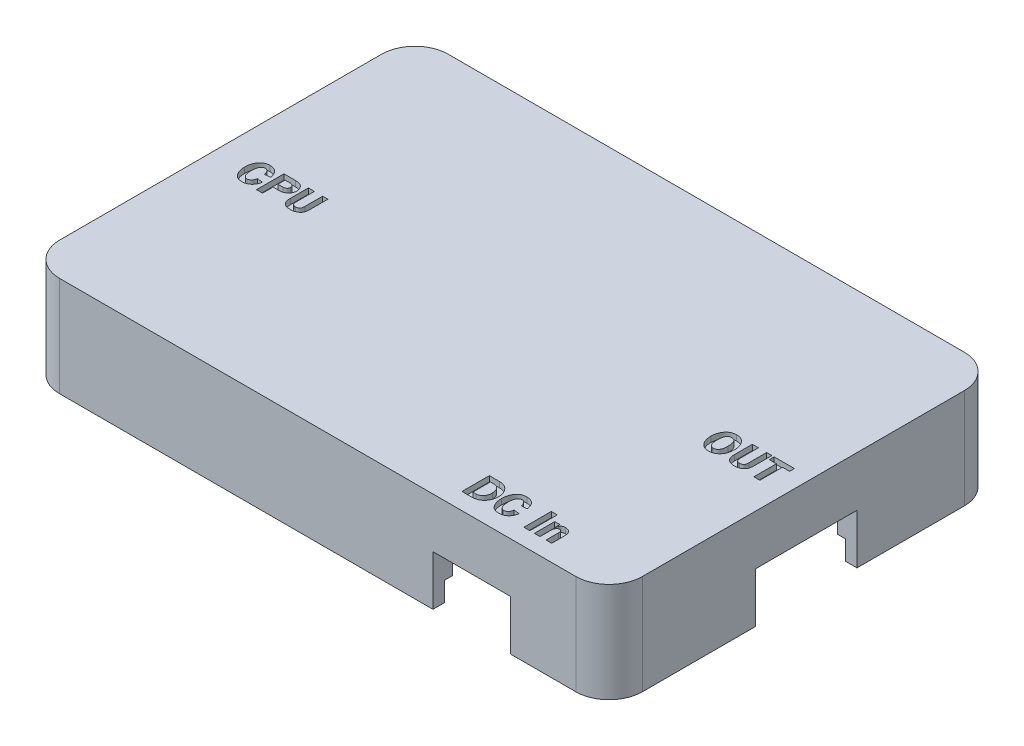
from build123d import *

# Parameters (mm, degrees)
SKETCH1_W           = 105
SKETCH1_H           = 70
BOSS_EXTRUDE1_DEPTH = 15
SKETCH3_W           = 98
SKETCH3_H           = 63
CUT_EXTRUDE1_DEPTH  = 12
FILLET1_R           = 6
SKETCH6_W           = 3.5
SKETCH6_H           = 18.3
SKETCH6_W_2         = 14
SKETCH6_H_2         = 3.5
SKETCH6_H_3         = 20
CUT_EXTRUDE3_DEPTH  = 26
CUT_EXTRUDE4_START  = -10
CUT_EXTRUDE4_DEPTH  = 10
BOSS_EXTRUDE3_DEPTH = 3
CUT_EXTRUDE5_DEPTH  = 3.5
SKETCH12_W          = 3.5
SKETCH12_H          = 18.3
SKETCH12_W_2        = 14
SKETCH12_H_2        = 3.5
SKETCH12_H_3        = 20
BOSS_EXTRUDE4_DEPTH = 6
SKETCH13_W          = 1.08279823
SKETCH13_H          = 4.940266927
CUT_EXTRUDE6_DEPTH  = 1


with BuildPart() as part:
    # Sketch1 → Boss-Extrude1 (new body)
    with BuildSketch(Plane(origin=(0, 0, 0), x_dir=(1, 0, 0), z_dir=(0, 1, 0))):
        Rectangle(SKETCH1_W, SKETCH1_H)
    extrude(amount=BOSS_EXTRUDE1_DEPTH)

    # Sketch3 → Cut-Extrude1 (cut)
    with BuildSketch(Plane(origin=(0, 15, 0), x_dir=(1, 0, 0), z_dir=(0, 1, 0))):
        Rectangle(SKETCH3_W, SKETCH3_H)
    extrude(amount=-CUT_EXTRUDE1_DEPTH, mode=Mode.SUBTRACT)

    # Fillet1
    fillet1_edges = [part.edges().sort_by_distance(p)[0] for p in [
        (-49, 9, 31.5),
        (-49, 9, -31.5),
        (49, 9, -31.5),
        (49, 9, 31.5),
        (52.5, 7.5, 35),
        (-52.5, 7.5, 35),
        (-52.5, 7.5, -35),
        (52.5, 7.5, -35),
    ]]
    fillet(fillet1_edges, radius=FILLET1_R)

    # Sketch6 → Cut-Extrude3 (cut)
    with BuildSketch(Plane(origin=(0, 15, 0), x_dir=(1, 0, 0), z_dir=(0, 1, 0))):
        with Locations((50.75, 0.51)):
            Rectangle(SKETCH6_W, SKETCH6_H)
        with Locations((27.76, -33.25)):
            Rectangle(SKETCH6_W_2, SKETCH6_H_2)
        with Locations((-50.75, 0)):
            Rectangle(SKETCH6_W, SKETCH6_H_3)
    extrude(amount=-CUT_EXTRUDE3_DEPTH, mode=Mode.SUBTRACT)

    # Sketch9 → Cut-Extrude4 (cut)
    with BuildSketch(Plane(origin=(0, 3, 0), x_dir=(1, 0, 0), z_dir=(0, 1, 0)).offset(CUT_EXTRUDE4_START)):
        with BuildLine():
            Line((-43, 31.5), (43, 31.5))
            ThreePointArc((43, 31.5), (47.242640687, 29.742640687), (49, 25.5))
            Line((49, 25.5), (49, -25.5))
            ThreePointArc((49, -25.5), (47.242640687, -29.742640687), (43, -31.5))
            Line((43, -31.5), (-43, -31.5))
            ThreePointArc((-43, -31.5), (-47.242640687, -29.742640687), (-49, -25.5))
            Line((-49, -25.5), (-49, 25.5))
            ThreePointArc((-49, 25.5), (-47.242640687, 29.742640687), (-43, 31.5))
        make_face()
    extrude(amount=CUT_EXTRUDE4_DEPTH, mode=Mode.SUBTRACT)


with BuildPart() as cut_extrude4_piece_1:
    # of the separate pieces the step leaves, piece 1, a body of its own (cut_extrude4_pieces)
    add(part.part.solids().sort_by_distance((-46.5, 0, -35))[0])

    # Sketch10 → Boss-Extrude3 (add)
    with BuildSketch(Plane(origin=(0, 15, 0), x_dir=(1, 0, 0), z_dir=(0, 1, 0))):
        with BuildLine():
            Line((-46.5, 35), (46.5, 35))
            ThreePointArc((46.5, 35), (50.742640687, 33.242640687), (52.5, 29))
            Line((52.5, 29), (52.5, -29))
            ThreePointArc((52.5, -29), (50.742640687, -33.242640687), (46.5, -35))
            Line((46.5, -35), (-46.5, -35))
            ThreePointArc((-46.5, -35), (-50.742640687, -33.242640687), (-52.5, -29))
            Line((-52.5, -29), (-52.5, 29))
            ThreePointArc((-52.5, 29), (-50.742640687, 33.242640687), (-46.5, 35))
        make_face()
    extrude(amount=BOSS_EXTRUDE3_DEPTH)


with BuildPart() as cut_extrude4_piece_2:
    # of the separate pieces the step leaves, piece 2, a body of its own (cut_extrude4_pieces)
    add(part.part.solids().sort_by_distance((-52.5, 0, 10))[0])


with BuildPart() as cut_extrude4_piece_3:
    # of the separate pieces the step leaves, piece 3, a body of its own (cut_extrude4_pieces)
    add(part.part.solids().sort_by_distance((49, 0, 8.64))[0])


with BuildPart() as cut_extrude5_tool:
    # Sketch11 → Cut-Extrude5 (new body)
    with BuildSketch(Plane(origin=(0, 0, 0), x_dir=(-1, 0, 0), z_dir=(0, -1, 0))):
        with BuildLine():
            Line((-44.4, 32.9), (44.4, 32.9))
            ThreePointArc((44.4, 32.9), (48.642640687, 31.142640687), (50.4, 26.9))
            Line((50.4, 26.9), (50.4, -26.9))
            ThreePointArc((50.4, -26.9), (48.642640687, -31.142640687), (44.4, -32.9))
            Line((44.4, -32.9), (-44.4, -32.9))
            ThreePointArc((-44.4, -32.9), (-48.642640687, -31.142640687), (-50.4, -26.9))
            Line((-50.4, -26.9), (-50.4, 26.9))
            ThreePointArc((-50.4, 26.9), (-48.642640687, 31.142640687), (-44.4, 32.9))
        make_face()
    extrude(amount=-CUT_EXTRUDE5_DEPTH)


with BuildPart() as cut_extrude4_piece_1_1:
    add(cut_extrude4_piece_1.part)

    # Cut-Extrude5: cut by cut_extrude5_tool
    add(cut_extrude5_tool.part, mode=Mode.SUBTRACT)



with BuildPart() as cut_extrude4_piece_2_1:
    add(cut_extrude4_piece_2.part)

    # Cut-Extrude5: cut by cut_extrude5_tool
    add(cut_extrude5_tool.part, mode=Mode.SUBTRACT)


with BuildPart() as cut_extrude4_piece_3_1:
    add(cut_extrude4_piece_3.part)

    # Cut-Extrude5: cut by cut_extrude5_tool
    add(cut_extrude5_tool.part, mode=Mode.SUBTRACT)


with BuildPart() as cut_extrude4_piece_1_2:
    add(cut_extrude4_piece_1_1.part)

    add(cut_extrude4_piece_2_1.part)  # Boss-Extrude4 merges Cut-Extrude4 piece 2

    add(cut_extrude4_piece_3_1.part)  # Boss-Extrude4 merges Cut-Extrude4 piece 3
    # Sketch12 → Boss-Extrude4 (add)
    with BuildSketch(Plane(origin=(0, 15, 0), x_dir=(-1, 0, 0), z_dir=(0, -1, 0))):
        with Locations((-50.75, 0.51)):
            Rectangle(SKETCH12_W, SKETCH12_H)
        with Locations((-27.76, -33.25)):
            Rectangle(SKETCH12_W_2, SKETCH12_H_2)
        with Locations((50.75, 0)):
            Rectangle(SKETCH12_W, SKETCH12_H_3)
    extrude(amount=BOSS_EXTRUDE4_DEPTH)

    # Sketch13 → Cut-Extrude6 (cut)
    # profile 1 of 10: a face of its own
    with BuildSketch(Plane(origin=(0, 18, 0), x_dir=(1, 0, 0), z_dir=(0, 1, 0))):
        with BuildLine():
            Line((-44.296016954, -1.604778249), (-43.287238134, -1.707348003))
            add(Edge.make_bspline(
                [(-43.287238134, -1.707348003), (-43.294953974, -1.770974891), (-43.31014873, -1.896274934), (-43.351483151, -2.07847792), (-43.403300697, -2.252766555), (-43.471670087, -2.416980091), (-43.552527511, -2.572136055), (-43.645316172, -2.719320307), (-43.754460427, -2.855478557), (-43.87404291, -2.983967734), (-44.007357324, -3.098613342), (-44.150792504, -3.200412741), (-44.306288288, -3.285363261), (-44.472928079, -3.353606277), (-44.64985806, -3.407995095), (-44.837439678, -3.44677983), (-45.035950388, -3.470528648), (-45.171845488, -3.473021879), (-45.241350566, -3.474297069)],
                knots=[0, 0, 0, 0, 1.051982192, 2.07166211, 3.064163433, 4.034902158, 4.987714795, 5.935166584, 6.887152378, 7.84950099, 8.813936601, 9.76952359, 10.733246651, 11.716896322, 12.722162435, 13.768923523, 14.858890826, 16, 16, 16, 16], degree=3))
            add(Edge.make_bspline(
                [(-45.241350566, -3.474297069), (-45.297073434, -3.473293841), (-45.405935008, -3.471333909), (-45.565144792, -3.45570261), (-45.715823592, -3.427543834), (-45.85949537, -3.391358362), (-45.99440018, -3.342408973), (-46.12191451, -3.284209572), (-46.2405956, -3.213874232), (-46.351945258, -3.133325988), (-46.454954218, -3.043132503), (-46.552282622, -2.946124841), (-46.64258613, -2.841502763), (-46.728196115, -2.730109147), (-46.805464075, -2.610130305), (-46.879734671, -2.484407137), (-46.944001726, -2.349518243), (-47.005150373, -2.209323742), (-47.056786136, -2.062587037), (-47.104174632, -1.912717561), (-47.141866561, -1.758166883), (-47.173250519, -1.600417191), (-47.199143137, -1.438947266), (-47.216778721, -1.274126348), (-47.22777127, -1.105475857), (-47.228786819, -0.991844224), (-47.229300442, -0.934373876)],
                knots=[0, 0, 0, 0, 1.105609578, 2.159946219, 3.169608684, 4.145018578, 5.096309205, 6.013193973, 6.922417586, 7.828974177, 8.736285872, 9.636371327, 10.553549476, 11.476787637, 12.421499323, 13.383578628, 14.372015653, 15.3840493, 16.417202389, 17.456939369, 18.501862101, 19.571742627, 20.648005113, 21.745532771, 22.859780399, 24, 24, 24, 24], degree=3))
            add(Edge.make_bspline(
                [(-47.229300442, -0.934373876), (-47.227740336, -0.843376833), (-47.224686341, -0.665245107), (-47.198912585, -0.404419674), (-47.156562558, -0.156452062), (-47.099311551, 0.079554926), (-47.022295431, 0.30195272), (-46.931216528, 0.512749207), (-46.81961203, 0.708893215), (-46.695336607, 0.892767541), (-46.554712403, 1.058764643), (-46.401255336, 1.205378481), (-46.232826735, 1.327380308), (-46.052407775, 1.427580587), (-45.859954683, 1.50688588), (-45.653966302, 1.560785937), (-45.436086991, 1.596255408), (-45.286260548, 1.599605927), (-45.209627961, 1.601319637)],
                knots=[0, 0, 0, 0, 1.198178484, 2.345500427, 3.447453775, 4.509103708, 5.539599216, 6.543499879, 7.528638035, 8.507148543, 9.462269331, 10.388250012, 11.295364851, 12.193024101, 13.10070884, 14.028537591, 14.991644863, 16, 16, 16, 16], degree=3))
            add(Edge.make_bspline(
                [(-45.209627961, 1.601319637), (-45.1454052, 1.599996685), (-45.019732846, 1.597407908), (-44.835885515, 1.574235883), (-44.660566268, 1.538883432), (-44.493998681, 1.488170289), (-44.336413268, 1.422166277), (-44.187540934, 1.341493634), (-44.047694246, 1.245647795), (-43.916151696, 1.136833749), (-43.795191782, 1.013657658), (-43.685965063, 0.876938173), (-43.589813638, 0.726419725), (-43.503701315, 0.564480455), (-43.430445575, 0.388891876), (-43.371313857, 0.19987699), (-43.320391621, -0.001127881), (-43.298458653, -0.140735254), (-43.287238134, -0.212155916)],
                knots=[0, 0, 0, 0, 1.053980237, 2.062449089, 3.037335328, 3.987379173, 4.915943175, 5.837774954, 6.762291017, 7.69511876, 8.636291522, 9.591555379, 10.562673013, 11.564478635, 12.599430281, 13.681008754, 14.813645119, 16, 16, 16, 16], degree=3))
            Line((-43.287238134, -0.212155916), (-44.288615013, -0.309438569))
            add(Edge.make_bspline(
                [(-44.288615013, -0.309438569), (-44.298191999, -0.267778765), (-44.316869871, -0.186530178), (-44.348919086, -0.069366921), (-44.386931586, 0.039231513), (-44.425823374, 0.140556243), (-44.471062158, 0.232970844), (-44.51836527, 0.318171086), (-44.569748786, 0.39512553), (-44.625341202, 0.463809165), (-44.684767561, 0.524008011), (-44.747113968, 0.57766644), (-44.814023883, 0.622109115), (-44.884682408, 0.658413598), (-44.958681954, 0.687104291), (-45.036720058, 0.70734755), (-45.118342155, 0.718903761), (-45.17399236, 0.720656724), (-45.20222602, 0.721546074)],
                knots=[0, 0, 0, 0, 1.364641525, 2.661443042, 3.874868095, 5.036638674, 6.123695894, 7.156520859, 8.145828854, 9.073718286, 9.972847736, 10.84306696, 11.695053518, 12.530457183, 13.374680603, 14.223466012, 15.098690498, 16, 16, 16, 16], degree=3))
            add(Edge.make_bspline(
                [(-45.20222602, 0.721546074), (-45.233699233, 0.720373973), (-45.295828138, 0.718060216), (-45.386637343, 0.698184391), (-45.473521274, 0.666515715), (-45.554942501, 0.620292169), (-45.63248488, 0.562100857), (-45.704937964, 0.491085011), (-45.773310144, 0.407387809), (-45.836497465, 0.311098652), (-45.893897507, 0.201478584), (-45.943076874, 0.078369939), (-45.985287672, -0.057780132), (-46.020150287, -0.207210061), (-46.045923923, -0.370537246), (-46.064693422, -0.54735451), (-46.076351277, -0.737538998), (-46.077984856, -0.86879676), (-46.078827322, -0.936488716)],
                knots=[0, 0, 0, 0, 0.726895696, 1.434910162, 2.138785806, 2.857458904, 3.590857252, 4.374590525, 5.196778853, 6.085005742, 7.032695212, 8.052607015, 9.145406711, 10.325446451, 11.59680084, 12.965544286, 14.435077357, 16, 16, 16, 16], degree=3))
            add(Edge.make_bspline(
                [(-46.078827322, -0.936488716), (-46.078098958, -1.005244616), (-46.076689454, -1.1382985), (-46.0635621, -1.330569576), (-46.044172784, -1.508923422), (-46.015863734, -1.673230806), (-45.979118578, -1.82387155), (-45.934228934, -1.960716155), (-45.88006297, -2.083111306), (-45.818858368, -2.191594612), (-45.750841469, -2.28611622), (-45.678483509, -2.367801543), (-45.603993932, -2.438551801), (-45.524505654, -2.494804116), (-45.44287067, -2.540769894), (-45.356061462, -2.570715591), (-45.266266399, -2.591140692), (-45.204809557, -2.593386026), (-45.173675676, -2.594523507)],
                knots=[0, 0, 0, 0, 1.578182673, 3.054040949, 4.422086023, 5.695161059, 6.87854739, 7.978818638, 8.996746236, 9.946184514, 10.833196196, 11.664422499, 12.448801434, 13.185309597, 13.895016738, 14.591171581, 15.286291109, 16, 16, 16, 16], degree=3))
            add(Edge.make_bspline(
                [(-45.173675676, -2.594523507), (-45.145433254, -2.593710421), (-45.089365261, -2.592096251), (-45.007050163, -2.579246027), (-44.927726712, -2.557723276), (-44.851639269, -2.528388738), (-44.778620871, -2.489569183), (-44.709355289, -2.442110432), (-44.643156759, -2.386138078), (-44.579911989, -2.323359004), (-44.522205835, -2.252589632), (-44.470208463, -2.176168216), (-44.42427863, -2.094192509), (-44.385803598, -2.006506064), (-44.352046778, -1.913879685), (-44.328000735, -1.815432718), (-44.306551567, -1.712286918), (-44.299584144, -1.641182419), (-44.296016954, -1.604778249)],
                knots=[0, 0, 0, 0, 0.929161302, 1.844608371, 2.733809141, 3.629943943, 4.52246771, 5.449091207, 6.387761928, 7.372056715, 8.377585556, 9.387853863, 10.410894549, 11.465029895, 12.536385021, 13.650531068, 14.797115969, 16, 16, 16, 16], degree=3))
        make_face()
    # profile 2 of 10: a face of its own
    with BuildSketch(Plane(origin=(0, 18, 0), x_dir=(1, 0, 0), z_dir=(0, 1, 0))):
        with BuildLine():
            Line((-41.544609732, -3.40662218), (-42.627407962, -3.40662218))
            Line((-42.627407962, -3.40662218), (-42.627407962, 1.533644747))
            Line((-42.627407962, 1.533644747), (-40.574955457, 1.533644747))
            add(Edge.make_bspline(
                [(-40.574955457, 1.533644747), (-40.500183136, 1.532218845), (-40.355609874, 1.529461844), (-40.146205874, 1.508472985), (-39.952088646, 1.472546801), (-39.772459703, 1.423753739), (-39.608544211, 1.35867853), (-39.459143738, 1.280839987), (-39.325795407, 1.186918076), (-39.208550235, 1.079423135), (-39.105973853, 0.963657766), (-39.016083499, 0.843029771), (-38.939628994, 0.718743641), (-38.878237324, 0.589419669), (-38.828488216, 0.457074363), (-38.795707586, 0.319879818), (-38.7728023, 0.179153333), (-38.770902094, 0.083664352), (-38.769939266, 0.035280399)],
                knots=[0, 0, 0, 0, 1.359773363, 2.629139583, 3.822342582, 4.946838289, 6.008686318, 7.023819875, 8.003792892, 8.965842641, 9.910259963, 10.812871024, 11.699009655, 12.559192182, 13.413045169, 14.265067297, 15.120915298, 16, 16, 16, 16], degree=3))
            add(Edge.make_bspline(
                [(-38.769939266, 0.035280399), (-38.771269227, -0.019437562), (-38.773872013, -0.12652281), (-38.797090762, -0.283744447), (-38.833350484, -0.433870359), (-38.886093454, -0.576853266), (-38.952118216, -0.71309784), (-39.036608004, -0.840320063), (-39.132140407, -0.962622912), (-39.2433889, -1.075054873), (-39.365785759, -1.177512248), (-39.497895866, -1.267831138), (-39.639373243, -1.342852289), (-39.789139114, -1.404769022), (-39.947295438, -1.453526515), (-40.11461899, -1.486469841), (-40.289898249, -1.508939729), (-40.409923352, -1.510782509), (-40.471328282, -1.511725276)],
                knots=[0, 0, 0, 0, 1.018665852, 1.993569996, 2.953750447, 3.890480617, 4.827118752, 5.766766339, 6.729569352, 7.713802092, 8.706559697, 9.698991611, 10.688814147, 11.683718633, 12.713787737, 13.765739752, 14.856950822, 16, 16, 16, 16], degree=3))
            Line((-40.471328282, -1.511725276), (-41.544609732, -1.511725276))
            Line((-41.544609732, -1.511725276), (-41.544609732, -3.40662218))
        make_face()
        with BuildLine():
            Line((-41.544609732, -0.631951714), (-40.66695101, -0.631951714))
            add(Edge.make_bspline(
                [(-40.66695101, -0.631951714), (-40.608978425, -0.63025106), (-40.499378318, -0.627035887), (-40.345858665, -0.594606156), (-40.214615852, -0.53946608), (-40.106197038, -0.462288781), (-40.022609428, -0.365136156), (-39.961713031, -0.252450341), (-39.926537629, -0.123990183), (-39.922501269, -0.033668426), (-39.920412386, 0.013074576)],
                knots=[0, 0, 0, 0, 1.241541437, 2.347196968, 3.342370143, 4.273487896, 5.173422332, 6.065966554, 6.999105747, 8, 8, 8, 8], degree=3))
            add(Edge.make_bspline(
                [(-39.920412386, 0.013074576), (-39.922207535, 0.055958475), (-39.925706681, 0.139548758), (-39.960238006, 0.259914778), (-40.015813643, 0.370076251), (-40.079806325, 0.452633833), (-40.142215808, 0.512724783), (-40.201173238, 0.550239383), (-40.269041779, 0.581694205), (-40.34538719, 0.610079572), (-40.432364305, 0.628682828), (-40.527963702, 0.643965217), (-40.632983519, 0.651897342), (-40.706065348, 0.653195049), (-40.74414268, 0.653871185)],
                knots=[0, 0, 0, 0, 1.294039653, 2.522371889, 3.752136745, 5.005688589, 5.661752901, 6.36236276, 7.106073407, 7.921965867, 8.819093097, 9.789867873, 10.848469742, 12, 12, 12, 12], degree=3))
            Line((-40.74414268, 0.653871185), (-41.544609732, 0.653871185))
            Line((-41.544609732, 0.653871185), (-41.544609732, -0.631951714))
        make_face(mode=Mode.SUBTRACT)
    # profile 3 of 10: a face of its own
    with BuildSketch(Plane(origin=(0, 18, 0), x_dir=(1, 0, 0), z_dir=(0, 1, 0))):
        with BuildLine():
            Line((-34.709445901, 1.533644747), (-34.709445901, -1.617467291))
            add(Edge.make_bspline(
                [(-34.709445901, -1.617467291), (-34.709856335, -1.668228411), (-34.71065474, -1.766972593), (-34.716695907, -1.910917702), (-34.728399457, -2.045991006), (-34.744200103, -2.172645594), (-34.764071089, -2.290524582), (-34.787754263, -2.399893493), (-34.817997034, -2.499939063), (-34.851441733, -2.592970433), (-34.892449893, -2.680611734), (-34.942176062, -2.764359719), (-35.002225229, -2.844673546), (-35.069770192, -2.923436667), (-35.147760985, -2.998578603), (-35.234664941, -3.071224364), (-35.329925, -3.142469736), (-35.434156885, -3.209532654), (-35.545313878, -3.271957072), (-35.663899779, -3.326014897), (-35.788050106, -3.372793994), (-35.919200496, -3.409178142), (-36.055290158, -3.439478061), (-36.19822391, -3.458685297), (-36.346782659, -3.472051238), (-36.448165561, -3.473540612), (-36.49965821, -3.474297069)],
                knots=[0, 0, 0, 0, 1.232909519, 2.398344302, 3.498197176, 4.525023179, 5.49755951, 6.401064252, 7.240745329, 8.0343409, 8.800303383, 9.58726796, 10.39545972, 11.233043339, 12.104842021, 13.022312987, 13.98286845, 14.992091959, 16.030663636, 17.076443674, 18.154591772, 19.249401951, 20.379492449, 21.538147082, 22.749618276, 24, 24, 24, 24], degree=3))
            add(Edge.make_bspline(
                [(-36.49965821, -3.474297069), (-36.548675396, -3.473821392), (-36.644715352, -3.472889393), (-36.785488425, -3.461671471), (-36.92011626, -3.445415178), (-37.047869783, -3.420898794), (-37.169518439, -3.390377025), (-37.284308313, -3.352396995), (-37.393023271, -3.307994398), (-37.494541285, -3.256329025), (-37.58854114, -3.19757694), (-37.676926942, -3.135285004), (-37.758501575, -3.067671436), (-37.83289377, -2.994520192), (-37.899704686, -2.915663475), (-37.960030368, -2.832353625), (-38.013173591, -2.743789195), (-38.060040726, -2.650194616), (-38.100068741, -2.550737976), (-38.133760362, -2.444846663), (-38.163349555, -2.333040019), (-38.187824322, -2.21483986), (-38.205096227, -2.090065007), (-38.219433737, -1.95965511), (-38.226217592, -1.822324113), (-38.227752761, -1.728853615), (-38.228540151, -1.6809125)],
                knots=[0, 0, 0, 0, 1.232927142, 2.415688846, 3.550816513, 4.643046955, 5.686186614, 6.704144379, 7.682352101, 8.638155303, 9.56594428, 10.468992341, 11.356891567, 12.228522285, 13.090353992, 13.954236325, 14.813509306, 15.685996709, 16.585117507, 17.50776422, 18.480004747, 19.493937418, 20.542378439, 21.648026349, 22.79367027, 24, 24, 24, 24], degree=3))
            Line((-38.228540151, -1.6809125), (-38.228540151, 1.533644747))
            Line((-38.228540151, 1.533644747), (-37.14574192, 1.533644747))
            Line((-37.14574192, 1.533644747), (-37.14574192, -1.628041492))
            add(Edge.make_bspline(
                [(-37.14574192, -1.628041492), (-37.145303828, -1.677762582), (-37.144470012, -1.772396368), (-37.13366151, -1.907268062), (-37.11709143, -2.028095816), (-37.094806174, -2.13531027), (-37.064015596, -2.228169057), (-37.027425012, -2.307624992), (-36.983380778, -2.37346253), (-36.914422419, -2.439151068), (-36.819766481, -2.500866823), (-36.698771782, -2.554080454), (-36.571035839, -2.589085012), (-36.482967001, -2.592694153), (-36.438327842, -2.594523507)],
                knots=[0, 0, 0, 0, 1.299600879, 2.473520833, 3.534320362, 4.486853006, 5.331918955, 6.08625075, 6.768716594, 7.387765943, 8.563420649, 9.70209071, 10.835266329, 12, 12, 12, 12], degree=3))
            add(Edge.make_bspline(
                [(-36.438327842, -2.594523507), (-36.38139681, -2.592131906), (-36.272633854, -2.587562911), (-36.117860003, -2.551762634), (-35.982618424, -2.489022598), (-35.882582728, -2.418404318), (-35.815924551, -2.344831402), (-35.772429678, -2.277387613), (-35.736620545, -2.197738398), (-35.707466371, -2.106484419), (-35.684565276, -2.003468564), (-35.667703298, -1.888999259), (-35.658576859, -1.762483924), (-35.657472384, -1.674229698), (-35.656894353, -1.628041492)],
                knots=[0, 0, 0, 0, 1.426096576, 2.724462796, 3.949706858, 5.144025048, 5.763171594, 6.427135233, 7.146488684, 7.9453966, 8.823982192, 9.788384409, 10.842542056, 12, 12, 12, 12], degree=3))
            Line((-35.656894353, -1.628041492), (-35.656894353, 1.533644747))
            Line((-35.656894353, 1.533644747), (-34.709445901, 1.533644747))
        make_face()
    # profile 4 of 10: a face of its own
    with BuildSketch(Plane(origin=(0, 18, 0), x_dir=(1, 0, 0), z_dir=(0, 1, 0))):
        with BuildLine():
            Line((22.973724226, -32), (22.973724226, -27.059733073))
            Line((22.973724226, -27.059733073), (24.8041185, -27.059733073))
            add(Edge.make_bspline(
                [(24.8041185, -27.059733073), (24.890229557, -27.061969879), (25.058558779, -27.066342369), (25.3039155, -27.100375113), (25.535208504, -27.157881503), (25.753445052, -27.236882172), (25.957564343, -27.340375407), (26.148473669, -27.465830609), (26.324683273, -27.615100178), (26.485392752, -27.784996101), (26.629246444, -27.970505305), (26.755872578, -28.166756446), (26.862735238, -28.372585526), (26.951512426, -28.587408996), (27.019077321, -28.81207287), (27.065877241, -29.046167032), (27.097030245, -29.288995484), (27.100254624, -29.454338321), (27.10189248, -29.538325898)],
                knots=[0, 0, 0, 0, 1.090662008, 2.132017583, 3.13055926, 4.105304072, 5.065861442, 6.023216668, 6.9928956, 7.984674896, 8.98061724, 9.962861141, 10.939516749, 11.914701274, 12.903561049, 13.906287412, 14.936477377, 16, 16, 16, 16], degree=3))
            add(Edge.make_bspline(
                [(27.10189248, -29.538325898), (27.10032845, -29.622319902), (27.097248598, -29.787718945), (27.065009047, -30.030641636), (27.016041658, -30.264378078), (26.945939283, -30.48854064), (26.855751767, -30.702607514), (26.746144098, -30.907568381), (26.615550159, -31.101852066), (26.467109634, -31.285978372), (26.299656667, -31.454927277), (26.11144023, -31.601204023), (25.905436931, -31.724899479), (25.68125611, -31.825483985), (25.439328601, -31.905051428), (25.179118764, -31.960387469), (24.901190552, -31.993300276), (24.71010062, -31.997722211), (24.611668034, -32)],
                knots=[0, 0, 0, 0, 1.020254704, 2.009061887, 2.972747181, 3.919798743, 4.85859884, 5.791949185, 6.740046485, 7.699418685, 8.662656393, 9.624092132, 10.588690998, 11.576040304, 12.604214078, 13.678002476, 14.803912809, 16, 16, 16, 16], degree=3))
            Line((24.611668034, -32), (22.973724226, -32))
        make_face()
        with BuildLine():
            Line((24.056522456, -31.120226438), (24.638103537, -31.120226438))
            add(Edge.make_bspline(
                [(24.638103537, -31.120226438), (24.682939125, -31.119052988), (24.771262875, -31.116741353), (24.900947279, -31.097069886), (25.025481175, -31.065611998), (25.144452508, -31.020238221), (25.259564136, -30.965014905), (25.36749257, -30.893565204), (25.472100821, -30.812219445), (25.570161207, -30.717063763), (25.660081974, -30.609404925), (25.739438016, -30.488880173), (25.804260899, -30.354755846), (25.858632175, -30.208596038), (25.900597377, -30.04993504), (25.929694353, -29.878279055), (25.947806165, -29.694507032), (25.95019227, -29.567624748), (25.95141936, -29.502373613)],
                knots=[0, 0, 0, 0, 0.916438432, 1.805335536, 2.675954657, 3.538148476, 4.405299458, 5.281006048, 6.179350956, 7.112196798, 8.06923501, 9.042850272, 10.055056242, 11.108757989, 12.227742205, 13.405651178, 14.665816834, 16, 16, 16, 16], degree=3))
            add(Edge.make_bspline(
                [(25.95141936, -29.502373613), (25.950450051, -29.448405614), (25.948551407, -29.34269528), (25.932258388, -29.187173956), (25.905811483, -29.038497137), (25.870487866, -28.895567101), (25.822054489, -28.760231985), (25.765514024, -28.630085601), (25.69596053, -28.507622031), (25.618668302, -28.391741106), (25.532596962, -28.285819355), (25.438047709, -28.193952124), (25.338364482, -28.114001333), (25.230676142, -28.050970016), (25.11757499, -27.999878816), (24.997106523, -27.965664606), (24.870476386, -27.943740025), (24.783768202, -27.940934981), (24.739615871, -27.939506635)],
                knots=[0, 0, 0, 0, 1.17395932, 2.299504067, 3.397675928, 4.457863975, 5.498370802, 6.521522045, 7.541247468, 8.557940523, 9.549685283, 10.504140474, 11.42158539, 12.322503077, 13.211725158, 14.114501384, 15.039892734, 16, 16, 16, 16], degree=3))
            Line((24.739615871, -27.939506635), (24.056522456, -27.939506635))
            Line((24.056522456, -27.939506635), (24.056522456, -31.120226438))
        make_face(mode=Mode.SUBTRACT)
    # profile 5 of 10: a face of its own
    with BuildSketch(Plane(origin=(0, 18, 0), x_dir=(1, 0, 0), z_dir=(0, 1, 0))):
        with BuildLine():
            Line((30.576575083, -30.198156069), (31.585353904, -30.300725824))
            add(Edge.make_bspline(
                [(31.585353904, -30.300725824), (31.577638064, -30.364352712), (31.562443307, -30.489652754), (31.521108887, -30.67185574), (31.46929134, -30.846144375), (31.40092195, -31.010357911), (31.320064526, -31.165513875), (31.227275866, -31.312698127), (31.118131611, -31.448856377), (30.998549127, -31.577345554), (30.865234714, -31.691991162), (30.721799533, -31.793790561), (30.56630375, -31.878741081), (30.399663958, -31.946984097), (30.222733978, -32.001372916), (30.03515236, -32.04015765), (29.83664165, -32.063906469), (29.70074655, -32.066399699), (29.631241472, -32.067674889)],
                knots=[0, 0, 0, 0, 1.051982192, 2.07166211, 3.064163433, 4.034902158, 4.987714795, 5.935166584, 6.887152378, 7.84950099, 8.813936601, 9.76952359, 10.733246651, 11.716896322, 12.722162435, 13.768923523, 14.858890826, 16, 16, 16, 16], degree=3))
            add(Edge.make_bspline(
                [(29.631241472, -32.067674889), (29.575518604, -32.066671661), (29.46665703, -32.064711729), (29.307447246, -32.04908043), (29.156768446, -32.020921655), (29.013096668, -31.984736182), (28.878191857, -31.935786794), (28.750677528, -31.877587392), (28.631996438, -31.807252052), (28.520646779, -31.726703808), (28.41763782, -31.636510323), (28.320309415, -31.539502662), (28.230005907, -31.434880583), (28.144395923, -31.323486967), (28.067127963, -31.203508125), (27.992857367, -31.077784958), (27.928590312, -30.942896063), (27.867441665, -30.802701562), (27.815805901, -30.655964857), (27.768417406, -30.506095381), (27.730725477, -30.351544703), (27.699341519, -30.193795011), (27.6734489, -30.032325086), (27.655813316, -29.867504168), (27.644820767, -29.698853677), (27.643805219, -29.585222044), (27.643291595, -29.527751696)],
                knots=[0, 0, 0, 0, 1.105609578, 2.159946219, 3.169608684, 4.145018578, 5.096309205, 6.013193973, 6.922417586, 7.828974177, 8.736285872, 9.636371327, 10.553549476, 11.476787637, 12.421499323, 13.383578628, 14.372015653, 15.3840493, 16.417202389, 17.456939369, 18.501862101, 19.571742627, 20.648005113, 21.745532771, 22.859780399, 24, 24, 24, 24], degree=3))
            add(Edge.make_bspline(
                [(27.643291595, -29.527751696), (27.644851702, -29.436754654), (27.647905697, -29.258622927), (27.673679453, -28.997797494), (27.71602948, -28.749829882), (27.773280486, -28.513822895), (27.850296606, -28.2914251), (27.94137551, -28.080628613), (28.052980008, -27.884484605), (28.177255431, -27.700610279), (28.317879635, -27.534613178), (28.471336702, -27.38799934), (28.639765302, -27.265997512), (28.820184263, -27.165797233), (29.012637355, -27.08649194), (29.218625735, -27.032591884), (29.436505047, -26.997122413), (29.58633149, -26.993771893), (29.662964076, -26.992058184)],
                knots=[0, 0, 0, 0, 1.198178484, 2.345500427, 3.447453775, 4.509103708, 5.539599216, 6.543499879, 7.528638035, 8.507148543, 9.462269331, 10.388250012, 11.295364851, 12.193024101, 13.10070884, 14.028537591, 14.991644863, 16, 16, 16, 16], degree=3))
            add(Edge.make_bspline(
                [(29.662964076, -26.992058184), (29.727186838, -26.993381135), (29.852859191, -26.995969912), (30.036706523, -27.019141937), (30.21202577, -27.054494389), (30.378593357, -27.105207531), (30.53617877, -27.171211544), (30.685051103, -27.251884186), (30.824897792, -27.347730026), (30.956440342, -27.456544071), (31.077400255, -27.579720162), (31.186626975, -27.716439647), (31.2827784, -27.866958095), (31.368890723, -28.028897365), (31.442146463, -28.204485945), (31.50127818, -28.39350083), (31.552200417, -28.594505701), (31.574133385, -28.734113074), (31.585353904, -28.805533736)],
                knots=[0, 0, 0, 0, 1.053980237, 2.062449089, 3.037335328, 3.987379173, 4.915943175, 5.837774954, 6.762291017, 7.69511876, 8.636291522, 9.591555379, 10.562673013, 11.564478635, 12.599430281, 13.681008754, 14.813645119, 16, 16, 16, 16], degree=3))
            Line((31.585353904, -28.805533736), (30.583977024, -28.902816389))
            add(Edge.make_bspline(
                [(30.583977024, -28.902816389), (30.574400039, -28.861156585), (30.555722166, -28.779907998), (30.523672952, -28.662744742), (30.485660452, -28.554146307), (30.446768664, -28.452821577), (30.401529879, -28.360406977), (30.354226768, -28.275206734), (30.302843252, -28.198252291), (30.247250836, -28.129568655), (30.187824477, -28.069369809), (30.12547807, -28.01571138), (30.058568155, -27.971268706), (29.98790963, -27.934964222), (29.913910084, -27.906273529), (29.835871979, -27.88603027), (29.754249882, -27.874474059), (29.698599678, -27.872721097), (29.670366017, -27.871831746)],
                knots=[0, 0, 0, 0, 1.364641525, 2.661443042, 3.874868095, 5.036638674, 6.123695894, 7.156520859, 8.145828854, 9.073718286, 9.972847736, 10.84306696, 11.695053518, 12.530457183, 13.374680603, 14.223466012, 15.098690498, 16, 16, 16, 16], degree=3))
            add(Edge.make_bspline(
                [(29.670366017, -27.871831746), (29.638892804, -27.873003847), (29.5767639, -27.875317604), (29.485954695, -27.895193429), (29.399070763, -27.926862105), (29.317649537, -27.973085651), (29.240107158, -28.031276963), (29.167654074, -28.102292809), (29.099281894, -28.185990011), (29.036094573, -28.282279168), (28.97869453, -28.391899236), (28.929515164, -28.515007881), (28.887304365, -28.651157952), (28.852441751, -28.800587881), (28.826668115, -28.963915067), (28.807898615, -29.140732331), (28.796240761, -29.330916818), (28.794607181, -29.46217458), (28.793764715, -29.529866536)],
                knots=[0, 0, 0, 0, 0.726895696, 1.434910162, 2.138785806, 2.857458904, 3.590857252, 4.374590525, 5.196778853, 6.085005742, 7.032695212, 8.052607015, 9.145406711, 10.325446451, 11.59680084, 12.965544286, 14.435077357, 16, 16, 16, 16], degree=3))
            add(Edge.make_bspline(
                [(28.793764715, -29.529866536), (28.79449308, -29.598622436), (28.795902583, -29.73167632), (28.809029938, -29.923947397), (28.828419254, -30.102301242), (28.856728303, -30.266608626), (28.89347346, -30.41724937), (28.938363103, -30.554093975), (28.992529068, -30.676489126), (29.053733669, -30.784972433), (29.121750568, -30.87949404), (29.194108528, -30.961179364), (29.268598106, -31.031929621), (29.348086384, -31.088181936), (29.429721368, -31.134147714), (29.516530575, -31.164093411), (29.606325638, -31.184518512), (29.667782481, -31.186763846), (29.698916361, -31.187901327)],
                knots=[0, 0, 0, 0, 1.578182673, 3.054040949, 4.422086023, 5.695161059, 6.87854739, 7.978818638, 8.996746236, 9.946184514, 10.833196196, 11.664422499, 12.448801434, 13.185309597, 13.895016738, 14.591171581, 15.286291109, 16, 16, 16, 16], degree=3))
            add(Edge.make_bspline(
                [(29.698916361, -31.187901327), (29.727158784, -31.187088241), (29.783226777, -31.185474071), (29.865541875, -31.172623848), (29.944865326, -31.151101096), (30.020952769, -31.121766558), (30.093971166, -31.082947003), (30.163236748, -31.035488252), (30.229435279, -30.979515898), (30.292680049, -30.916736824), (30.350386202, -30.845967452), (30.402383575, -30.769546036), (30.448313408, -30.687570329), (30.48678844, -30.599883885), (30.52054526, -30.507257506), (30.544591303, -30.408810539), (30.56604047, -30.305664738), (30.573007893, -30.234560239), (30.576575083, -30.198156069)],
                knots=[0, 0, 0, 0, 0.929161302, 1.844608371, 2.733809141, 3.629943943, 4.52246771, 5.449091207, 6.387761928, 7.372056715, 8.377585556, 9.387853863, 10.410894549, 11.465029895, 12.536385021, 13.650531068, 14.797115969, 16, 16, 16, 16], degree=3))
        make_face()
    # profile 6 of 10: a face of its own
    with BuildSketch(Plane(origin=(0, 18, 0), x_dir=(1, 0, 0), z_dir=(0, 1, 0))):
        with Locations((34.681480094, -29.529866537)):
            Rectangle(SKETCH13_W, SKETCH13_H)
    # profile 7 of 10: a face of its own
    with BuildSketch(Plane(origin=(0, 18, 0), x_dir=(1, 0, 0), z_dir=(0, 1, 0))):
        with BuildLine():
            Line((39.148022795, -32), (38.132899454, -32))
            Line((38.132899454, -32), (38.132899454, -29.725489264))
            add(Edge.make_bspline(
                [(38.132899454, -29.725489264), (38.131623329, -29.674943611), (38.129228863, -29.580101945), (38.102816358, -29.448254028), (38.060081137, -29.336224562), (37.998824923, -29.246142079), (37.92643237, -29.17657919), (37.846723934, -29.1269638), (37.760591863, -29.094777142), (37.700343289, -29.091595416), (37.66974943, -29.089979755)],
                knots=[0, 0, 0, 0, 1.376160093, 2.582166986, 3.647364909, 4.622755064, 5.526615688, 6.363821952, 7.169158732, 8, 8, 8, 8], degree=3))
            add(Edge.make_bspline(
                [(37.66974943, -29.089979755), (37.633332364, -29.092875748), (37.558412449, -29.098833601), (37.449768386, -29.148958088), (37.345486621, -29.227500495), (37.263723822, -29.313837032), (37.200422353, -29.396701553), (37.161598222, -29.472956002), (37.125703164, -29.556587995), (37.099103967, -29.650968571), (37.076876101, -29.754048294), (37.061334479, -29.866799314), (37.05174646, -29.988618457), (37.050662741, -30.073008778), (37.050101224, -30.116734718)],
                knots=[0, 0, 0, 0, 0.986475648, 2.029451579, 3.194618528, 4.52282298, 5.249123319, 6.020716581, 6.841040592, 7.720244241, 8.680547509, 9.706304989, 10.81154652, 12, 12, 12, 12], degree=3))
            Line((37.050101224, -30.116734718), (37.050101224, -32))
            Line((37.050101224, -32), (36.034977882, -32))
            Line((36.034977882, -32), (36.034977882, -28.345555972))
            Line((36.034977882, -28.345555972), (36.980311494, -28.345555972))
            Line((36.980311494, -28.345555972), (36.980311494, -29.165056586))
            add(Edge.make_bspline(
                [(36.980311494, -29.165056586), (36.988704747, -29.128995811), (37.005036396, -29.058828507), (37.035820515, -28.958188588), (37.07082468, -28.864620339), (37.109644932, -28.777873842), (37.153165559, -28.697960158), (37.201098287, -28.625223932), (37.250980318, -28.557577243), (37.308057464, -28.499738012), (37.367414488, -28.447297206), (37.431067696, -28.401102848), (37.500145473, -28.363711969), (37.572325157, -28.331300432), (37.648968556, -28.306951637), (37.729482622, -28.29060541), (37.813941203, -28.279229887), (37.871676643, -28.278338711), (37.901324442, -28.277881082)],
                knots=[0, 0, 0, 0, 1.267660028, 2.466621654, 3.601080754, 4.686979916, 5.718730116, 6.71308556, 7.669117433, 8.591089876, 9.489287681, 10.380319333, 11.277218461, 12.174361233, 13.086722501, 14.024209804, 14.985409455, 16, 16, 16, 16], degree=3))
            add(Edge.make_bspline(
                [(37.901324442, -28.277881082), (37.944363094, -28.278979664), (38.029286093, -28.281147363), (38.153947151, -28.295784874), (38.273089121, -28.321482027), (38.387178924, -28.356432143), (38.496226152, -28.401549458), (38.599347457, -28.458660188), (38.697801098, -28.523854676), (38.790496795, -28.599334967), (38.876210927, -28.685761151), (38.949222502, -28.787416085), (39.010540304, -28.901794035), (39.06173512, -29.028596697), (39.100146643, -29.169243163), (39.128493192, -29.32271801), (39.145474709, -29.48930289), (39.147154149, -29.604550195), (39.148022795, -29.664158895)],
                knots=[0, 0, 0, 0, 0.973350212, 1.920594988, 2.833681207, 3.726285566, 4.616037691, 5.49717772, 6.38817882, 7.28334242, 8.196567818, 9.132542298, 10.102753717, 11.125636193, 12.218441832, 13.39419033, 14.652212062, 16, 16, 16, 16], degree=3))
            Line((39.148022795, -29.664158895), (39.148022795, -32))
        make_face()
    # profile 8 of 10: a face of its own
    with BuildSketch(Plane(origin=(0, 18, 0), x_dir=(1, 0, 0), z_dir=(0, 1, 0))):
        with BuildLine():
            add(Edge.make_bspline(
                [(38.849587567, -3.474297069), (38.769430338, -3.472223332), (38.612902811, -3.468173828), (38.385418043, -3.431918472), (38.17109238, -3.376156747), (37.971753625, -3.293093411), (37.785107085, -3.18937352), (37.61302011, -3.061451838), (37.454821194, -2.910406042), (37.312416215, -2.737381533), (37.186037176, -2.547615276), (37.073449507, -2.347051365), (36.981472007, -2.134560103), (36.902867165, -1.912753129), (36.844791415, -1.679166268), (36.801005191, -1.435890361), (36.775389511, -1.181655216), (36.772283832, -1.008803056), (36.770699558, -0.920627414)],
                knots=[0, 0, 0, 0, 1.039599213, 2.030083839, 2.982134293, 3.907219666, 4.824707676, 5.74691592, 6.681979156, 7.656565762, 8.648696834, 9.637712126, 10.637229113, 11.649911205, 12.688362501, 13.757051954, 14.855823476, 16, 16, 16, 16], degree=3))
            add(Edge.make_bspline(
                [(36.770699558, -0.920627414), (36.77267442, -0.833506207), (36.776561387, -0.66203237), (36.802819053, -0.410155169), (36.848434447, -0.169021777), (36.911932831, 0.061280692), (36.993174429, 0.281410945), (37.094499887, 0.489996606), (37.211972457, 0.689163568), (37.347628355, 0.875039395), (37.497794275, 1.045016101), (37.661079243, 1.194329029), (37.837006965, 1.31996313), (38.02409471, 1.423573959), (38.223879845, 1.503243964), (38.434958499, 1.560181865), (38.657765904, 1.594727619), (38.809986194, 1.599092507), (38.887654692, 1.601319637)],
                knots=[0, 0, 0, 0, 1.134637075, 2.233217125, 3.293820626, 4.327364149, 5.341237955, 6.345253085, 7.343542727, 8.348984134, 9.337515505, 10.292939359, 11.224157764, 12.146690851, 13.071608, 14.018179043, 14.988800656, 16, 16, 16, 16], degree=3))
            add(Edge.make_bspline(
                [(38.887654692, 1.601319637), (38.969916316, 1.599227589), (39.130631426, 1.595140341), (39.364513503, 1.559096836), (39.584990348, 1.502537463), (39.791859506, 1.422241039), (39.983407757, 1.316210744), (40.161118506, 1.188346755), (40.32571505, 1.038345918), (40.471900803, 0.864584156), (40.603065555, 0.675922276), (40.719269589, 0.476515427), (40.816855193, 0.26621317), (40.895811014, 0.045497116), (40.958630035, -0.184569765), (41.002698944, -0.424729801), (41.029782038, -0.674678571), (41.032723202, -0.844776064), (41.034217591, -0.931201616)],
                knots=[0, 0, 0, 0, 1.058532583, 2.068062531, 3.03886663, 3.984384552, 4.916621343, 5.849829607, 6.797360046, 7.77588671, 8.766648438, 9.752816314, 10.743598827, 11.74699039, 12.767486479, 13.810635302, 14.887596476, 16, 16, 16, 16], degree=3))
            add(Edge.make_bspline(
                [(41.034217591, -0.931201616), (41.032421137, -1.022216293), (41.028910211, -1.200092121), (41.00054474, -1.460556587), (40.95606592, -1.708716355), (40.890860548, -1.944467647), (40.809196775, -2.168378712), (40.706515981, -2.378923654), (40.586892945, -2.577363003), (40.450151362, -2.762085141), (40.297381907, -2.929039104), (40.130376461, -3.07540497), (39.949326358, -3.198989533), (39.754645155, -3.299827199), (39.547011203, -3.378355657), (39.32650152, -3.434641874), (39.092370511, -3.467443588), (38.93181794, -3.471975801), (38.849587567, -3.474297069)],
                knots=[0, 0, 0, 0, 1.1580871, 2.26332396, 3.330619845, 4.36341896, 5.372565307, 6.359685032, 7.339828269, 8.317782434, 9.279803142, 10.214546408, 11.137787035, 12.062748036, 12.998384325, 13.956936771, 14.953602242, 16, 16, 16, 16], degree=3))
        make_face()
        with BuildLine():
            add(Edge.make_bspline(
                [(38.858046928, -2.594523507), (38.893021565, -2.59365246), (38.961987068, -2.591934868), (39.063298583, -2.573894758), (39.161148361, -2.546978531), (39.254601025, -2.507213529), (39.343899322, -2.45718484), (39.429318845, -2.396546998), (39.509700703, -2.323469577), (39.588086187, -2.240305097), (39.658486894, -2.140247485), (39.720508052, -2.022646853), (39.769879602, -1.884849207), (39.812036062, -1.729298211), (39.844408158, -1.554934565), (39.866747097, -1.361683579), (39.88217742, -1.149630887), (39.883208561, -1.001726577), (39.883744471, -0.924857095)],
                knots=[0, 0, 0, 0, 0.759336547, 1.497314367, 2.229664932, 2.960932997, 3.698274424, 4.450740761, 5.231941405, 6.055913687, 6.929490506, 7.882082317, 8.936452772, 10.103461589, 11.381997983, 12.786321787, 14.329772955, 16, 16, 16, 16], degree=3))
            add(Edge.make_bspline(
                [(39.883744471, -0.924857095), (39.882905124, -0.861392296), (39.881271601, -0.737878), (39.869448418, -0.558283213), (39.851023532, -0.38945016), (39.823558837, -0.231985668), (39.788714384, -0.08539518), (39.746871288, 0.050646696), (39.696110073, 0.175455331), (39.638174488, 0.289560444), (39.571811795, 0.391226835), (39.497475859, 0.480276311), (39.414276207, 0.555260766), (39.322098284, 0.616026395), (39.222203197, 0.663984578), (39.113992909, 0.697899524), (38.997704906, 0.718418626), (38.917349172, 0.720483917), (38.87602307, 0.721546074)],
                knots=[0, 0, 0, 0, 1.402008333, 2.728568858, 3.974612556, 5.152409489, 6.257314975, 7.301587928, 8.293568993, 9.230408436, 10.124559608, 10.970051344, 11.78616594, 12.589587933, 13.401120195, 14.226139399, 15.087722299, 16, 16, 16, 16], degree=3))
            add(Edge.make_bspline(
                [(38.87602307, 0.721546074), (38.837509373, 0.720470658), (38.76204392, 0.718363439), (38.652913126, 0.697706233), (38.55112102, 0.664919625), (38.457148172, 0.618959698), (38.370287063, 0.560250068), (38.291854413, 0.487363077), (38.220288046, 0.40185746), (38.157136791, 0.30273795), (38.101110978, 0.191038651), (38.052668424, 0.066694241), (38.011602862, -0.07053455), (37.977796927, -0.220662864), (37.953391583, -0.384385419), (37.933865849, -0.560698494), (37.92405006, -0.750273104), (37.922151903, -0.880789367), (37.921172678, -0.948120338)],
                knots=[0, 0, 0, 0, 0.854930696, 1.675189225, 2.457795313, 3.22484706, 3.991618898, 4.778679417, 5.595904034, 6.462661834, 7.383792682, 8.368358357, 9.423787974, 10.563755351, 11.784371404, 13.099814529, 14.503846941, 16, 16, 16, 16], degree=3))
            add(Edge.make_bspline(
                [(37.921172678, -0.948120338), (37.922025757, -1.016164153), (37.923675768, -1.147773258), (37.935130876, -1.338359002), (37.954660603, -1.514949939), (37.983396825, -1.677671669), (38.018971012, -1.826833143), (38.061562109, -1.962729777), (38.1136927, -2.084581157), (38.173786059, -2.192575322), (38.240771493, -2.287332894), (38.312834423, -2.369516636), (38.390401596, -2.439125234), (38.473865464, -2.495481694), (38.561856265, -2.541004424), (38.656329983, -2.571049905), (38.755331126, -2.591160963), (38.823401644, -2.593389346), (38.858046928, -2.594523507)],
                knots=[0, 0, 0, 0, 1.544640952, 2.987616354, 4.332504632, 5.575666337, 6.736229778, 7.811693995, 8.804570049, 9.739525736, 10.612030705, 11.434017709, 12.216130882, 12.970703651, 13.715024757, 14.456415453, 15.214374631, 16, 16, 16, 16], degree=3))
        make_face(mode=Mode.SUBTRACT)
    # profile 9 of 10: a face of its own
    with BuildSketch(Plane(origin=(0, 18, 0), x_dir=(1, 0, 0), z_dir=(0, 1, 0))):
        with BuildLine():
            Line((45.297735624, 1.533644747), (45.297735624, -1.617467291))
            add(Edge.make_bspline(
                [(45.297735624, -1.617467291), (45.29732519, -1.668228411), (45.296526785, -1.766972593), (45.290485617, -1.910917702), (45.278782068, -2.045991006), (45.262981422, -2.172645594), (45.243110435, -2.290524582), (45.219427262, -2.399893493), (45.189184491, -2.499939063), (45.155739792, -2.592970433), (45.114731632, -2.680611734), (45.065005462, -2.764359719), (45.004956295, -2.844673546), (44.937411332, -2.923436667), (44.859420539, -2.998578603), (44.772516583, -3.071224364), (44.677256525, -3.142469736), (44.573024639, -3.209532654), (44.461867647, -3.271957072), (44.343281746, -3.326014897), (44.219131419, -3.372793994), (44.087981029, -3.409178142), (43.951891367, -3.439478061), (43.808957615, -3.458685297), (43.660398866, -3.472051238), (43.559015963, -3.473540612), (43.507523315, -3.474297069)],
                knots=[0, 0, 0, 0, 1.232909519, 2.398344302, 3.498197176, 4.525023179, 5.49755951, 6.401064252, 7.240745329, 8.0343409, 8.800303383, 9.58726796, 10.39545972, 11.233043339, 12.104842021, 13.022312987, 13.98286845, 14.992091959, 16.030663636, 17.076443674, 18.154591772, 19.249401951, 20.379492449, 21.538147082, 22.749618276, 24, 24, 24, 24], degree=3))
            add(Edge.make_bspline(
                [(43.507523315, -3.474297069), (43.458506129, -3.473821392), (43.362466173, -3.472889393), (43.2216931, -3.461671471), (43.087065265, -3.445415178), (42.959311742, -3.420898794), (42.837663086, -3.390377025), (42.722873212, -3.352396995), (42.614158254, -3.307994398), (42.51264024, -3.256329025), (42.418640385, -3.19757694), (42.330254583, -3.135285004), (42.248679949, -3.067671436), (42.174287754, -2.994520192), (42.107476839, -2.915663475), (42.047151157, -2.832353625), (41.994007934, -2.743789195), (41.947140799, -2.650194616), (41.907112783, -2.550737976), (41.873421163, -2.444846663), (41.84383197, -2.333040019), (41.819357203, -2.21483986), (41.802085298, -2.090065007), (41.787747788, -1.95965511), (41.780963933, -1.822324113), (41.779428764, -1.728853615), (41.778641374, -1.6809125)],
                knots=[0, 0, 0, 0, 1.232927142, 2.415688846, 3.550816513, 4.643046955, 5.686186614, 6.704144379, 7.682352101, 8.638155303, 9.56594428, 10.468992341, 11.356891567, 12.228522285, 13.090353992, 13.954236325, 14.813509306, 15.685996709, 16.585117507, 17.50776422, 18.480004747, 19.493937418, 20.542378439, 21.648026349, 22.79367027, 24, 24, 24, 24], degree=3))
            Line((41.778641374, -1.6809125), (41.778641374, 1.533644747))
            Line((41.778641374, 1.533644747), (42.861439605, 1.533644747))
            Line((42.861439605, 1.533644747), (42.861439605, -1.628041492))
            add(Edge.make_bspline(
                [(42.861439605, -1.628041492), (42.861877696, -1.677762582), (42.862711513, -1.772396368), (42.873520015, -1.907268062), (42.890090095, -2.028095816), (42.912375351, -2.13531027), (42.943165929, -2.228169057), (42.979756512, -2.307624992), (43.023800747, -2.37346253), (43.092759106, -2.439151068), (43.187415044, -2.500866823), (43.308409742, -2.554080454), (43.436145686, -2.589085012), (43.524214523, -2.592694153), (43.568853683, -2.594523507)],
                knots=[0, 0, 0, 0, 1.299600879, 2.473520833, 3.534320362, 4.486853006, 5.331918955, 6.08625075, 6.768716594, 7.387765943, 8.563420649, 9.70209071, 10.835266329, 12, 12, 12, 12], degree=3))
            add(Edge.make_bspline(
                [(43.568853683, -2.594523507), (43.625784715, -2.592131906), (43.73454767, -2.587562911), (43.889321521, -2.551762634), (44.0245631, -2.489022598), (44.124598796, -2.418404318), (44.191256974, -2.344831402), (44.234751847, -2.277387613), (44.27056098, -2.197738398), (44.299715154, -2.106484419), (44.322616249, -2.003468564), (44.339478226, -1.888999259), (44.348604665, -1.762483924), (44.34970914, -1.674229698), (44.350287172, -1.628041492)],
                knots=[0, 0, 0, 0, 1.426096576, 2.724462796, 3.949706858, 5.144025048, 5.763171594, 6.427135233, 7.146488684, 7.9453966, 8.823982192, 9.788384409, 10.842542056, 12, 12, 12, 12], degree=3))
            Line((44.350287172, -1.628041492), (44.350287172, 1.533644747))
            Line((44.350287172, 1.533644747), (45.297735624, 1.533644747))
        make_face()
    # profile 10 of 10: a face of its own
    with BuildSketch(Plane(origin=(0, 18, 0), x_dir=(1, 0, 0), z_dir=(0, 1, 0))):
        Polygon((48.072406089, -3.40662218), (46.989607859, -3.40662218), (46.989607859, 0.653871185), (45.70378496, 0.653871185), (45.70378496, 1.533644747), (49.358228988, 1.533644747), (49.358228988, 0.653871185), (48.072406089, 0.653871185), align=None)
    extrude(amount=-CUT_EXTRUDE6_DEPTH, mode=Mode.SUBTRACT)


solid = cut_extrude4_piece_1_2.part
